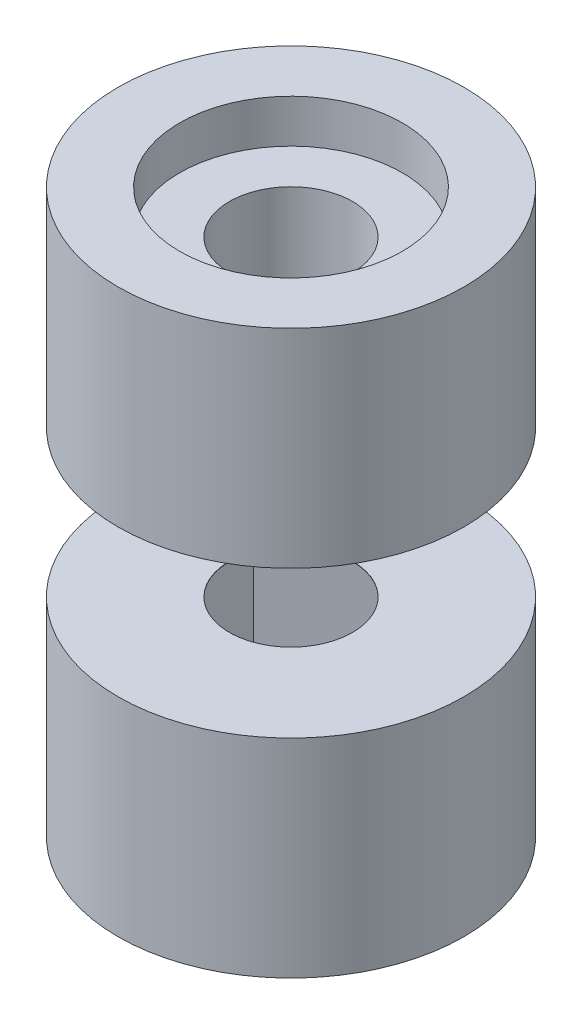
from build123d import *

# Parameters (mm, degrees)
SKETCH1_R               = 8
BOSS_EXTRUDE1_DEPTH     = 26.03
CUT_EXTRUDE1_DEPTH      = 29.382404761
CUT_EXTRUDE1_DEPTH_BACK = 29.382404761
SKETCH2_W               = 20.4
SKETCH2_H               = 6.8
SKETCH3_R               = 2.85
CUT_EXTRUDE2_DEPTH      = 26.03
SKETCH4_R               = 5.15
CUT_EXTRUDE3_DEPTH      = 2
CUT_EXTRUDE4_DEPTH      = 9.6


with BuildPart() as part:
    # Sketch1 → Boss-Extrude1 (new body)
    with BuildSketch(Plane(origin=(0, 0, 0), x_dir=(1, 0, 0), z_dir=(0, 1, 0))):
        with Locations(Location((0, 0, 0), (0, 0, 270))):
            Circle(SKETCH1_R)
    extrude(amount=BOSS_EXTRUDE1_DEPTH)

    # Sketch2 → Cut-Extrude1 (cut, two sides: drawn at the far end of the back side and taken through both)
    with BuildSketch(Plane.XY.offset(-CUT_EXTRUDE1_DEPTH_BACK)):
        with Locations((0, 13.015)):
            Rectangle(SKETCH2_W, SKETCH2_H)
    extrude(amount=CUT_EXTRUDE1_DEPTH + CUT_EXTRUDE1_DEPTH_BACK, mode=Mode.SUBTRACT)


with BuildPart() as cut_extrude1_piece_1:
    # of the separate pieces the step leaves, piece 1, a body of its own (cut_extrude1_pieces)
    add(part.part.solids().sort_by_distance((0, 16.415, 8))[0])


with BuildPart() as cut_extrude1_piece_2:
    # of the separate pieces the step leaves, piece 2, a body of its own (cut_extrude1_pieces)
    add(part.part.solids().sort_by_distance((0, 0, 8))[0])


with BuildPart() as cut_extrude2_tool:
    # Sketch3 → Cut-Extrude2 (new body)
    with BuildSketch(Plane(origin=(0, 0, 0), x_dir=(1, 0, 0), z_dir=(0, 1, 0))):
        with Locations(Location((0, 0, 0), (0, 0, 270))):
            Circle(SKETCH3_R)
    extrude(amount=CUT_EXTRUDE2_DEPTH)


with BuildPart() as cut_extrude1_piece_1_1:
    add(cut_extrude1_piece_1.part)

    # Cut-Extrude2: cut by cut_extrude2_tool
    add(cut_extrude2_tool.part, mode=Mode.SUBTRACT)

    # Sketch4 → Cut-Extrude3 (cut)
    with BuildSketch(Plane(origin=(0, 26.03, 0), x_dir=(1, 0, 0), z_dir=(0, 1, 0))):
        with Locations(Location((0, 0, 0), (0, 0, 270))):
            Circle(SKETCH4_R)
    extrude(amount=-CUT_EXTRUDE3_DEPTH, mode=Mode.SUBTRACT)


with BuildPart() as cut_extrude1_piece_2_1:
    add(cut_extrude1_piece_2.part)

    # Cut-Extrude2: cut by cut_extrude2_tool
    add(cut_extrude2_tool.part, mode=Mode.SUBTRACT)

    # Sketch5 → Cut-Extrude4 (cut)
    with BuildSketch(Plane(origin=(0, 0, 0), x_dir=(1, 0, 0), z_dir=(0, 1, 0))):
        Polygon((4.1, -2.367136104), (0, -4.734272207), (-4.1, -2.367136104), (-4.1, 2.367136104), (0, 4.734272207), (4.1, 2.367136104), align=None)
    extrude(amount=CUT_EXTRUDE4_DEPTH, mode=Mode.SUBTRACT)


solid = Compound([cut_extrude1_piece_1_1.part, cut_extrude1_piece_2_1.part])
